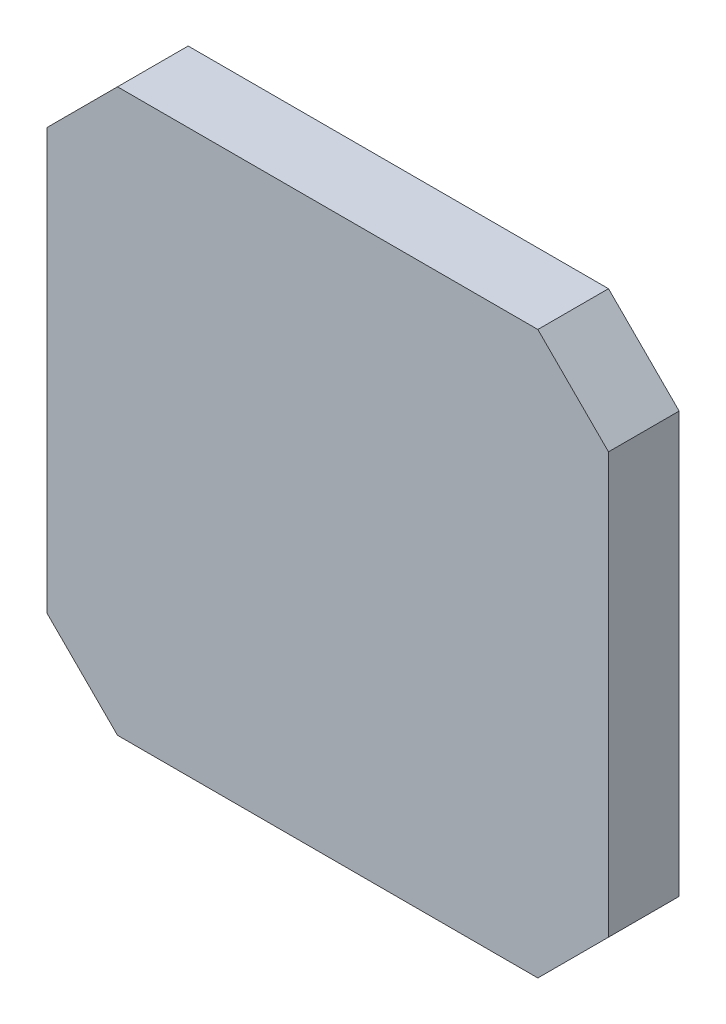
from build123d import *

# Parameters (mm, degrees)
SKETCH_1_W      = 159
SKETCH_1_H      = 159
EXTRUDE_1_DEPTH = 20
CHAMFER_1_SIZE  = 20


with BuildPart() as part:
    # 草图1 → 凸台-拉伸1 (new body)
    with BuildSketch(Plane.XY):
        Rectangle(SKETCH_1_W, SKETCH_1_H)
    extrude(amount=EXTRUDE_1_DEPTH)

    # 倒角1
    chamfer_1_edges = [part.edges().sort_by_distance(p)[0] for p in [
        (79.5, -79.5, 10),
        (-79.5, -79.5, 10),
        (-79.5, 79.5, 10),
        (79.5, 79.5, 10),
    ]]
    chamfer(chamfer_1_edges, length=CHAMFER_1_SIZE)


solid = part.part
